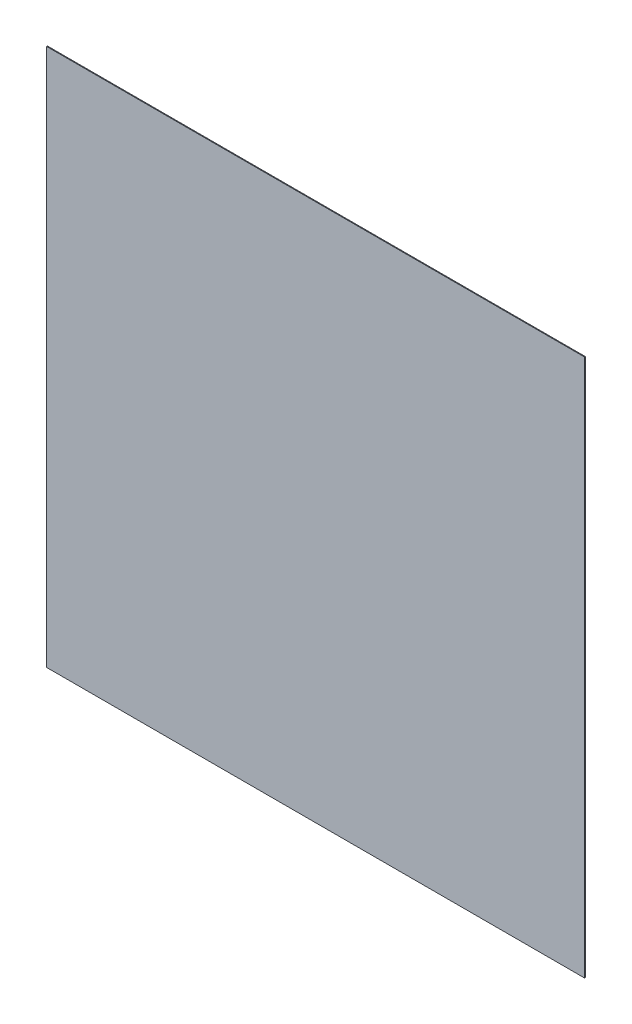
from build123d import *

# Parameters (mm, degrees)
SKETCH1_W           = 20
SKETCH1_H           = 20
BOSS_EXTRUDE1_DEPTH = 0.03


with BuildPart() as part:
    # Sketch1 → Boss-Extrude1 (new body)
    with BuildSketch(Plane.XY):
        Rectangle(SKETCH1_W, SKETCH1_H)
    extrude(amount=BOSS_EXTRUDE1_DEPTH)


solid = part.part
